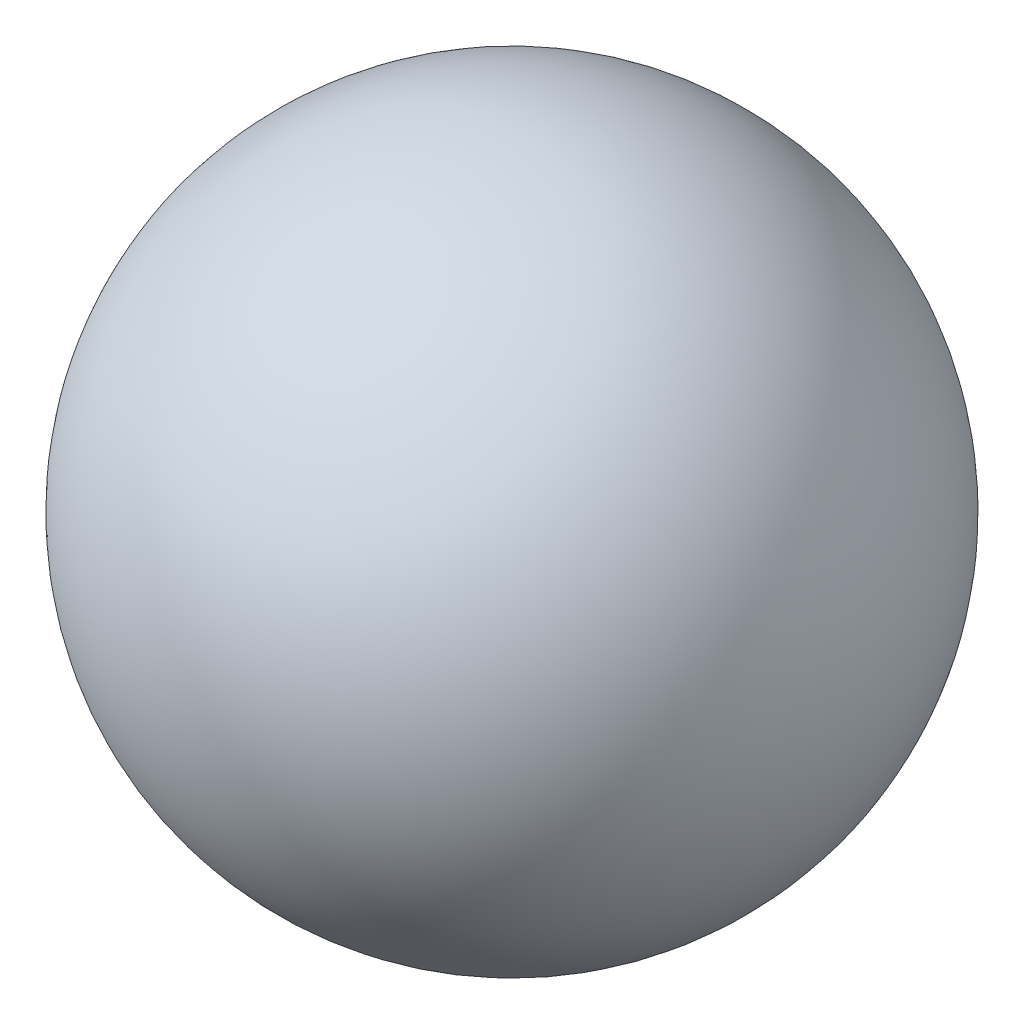
from build123d import *


with BuildPart() as part:
    # Esquisse1 → Révolution1 (revolve)
    with BuildSketch(Plane.XY):
        with BuildLine():
            Line((-0.75, 0), (0.75, 0))
            ThreePointArc((0.75, 0), (0, 0.75), (-0.75, 0))
        make_face()
    revolve(axis=Axis((-0.75, 0, 0), (1, 0, 0)))


solid = part.part
